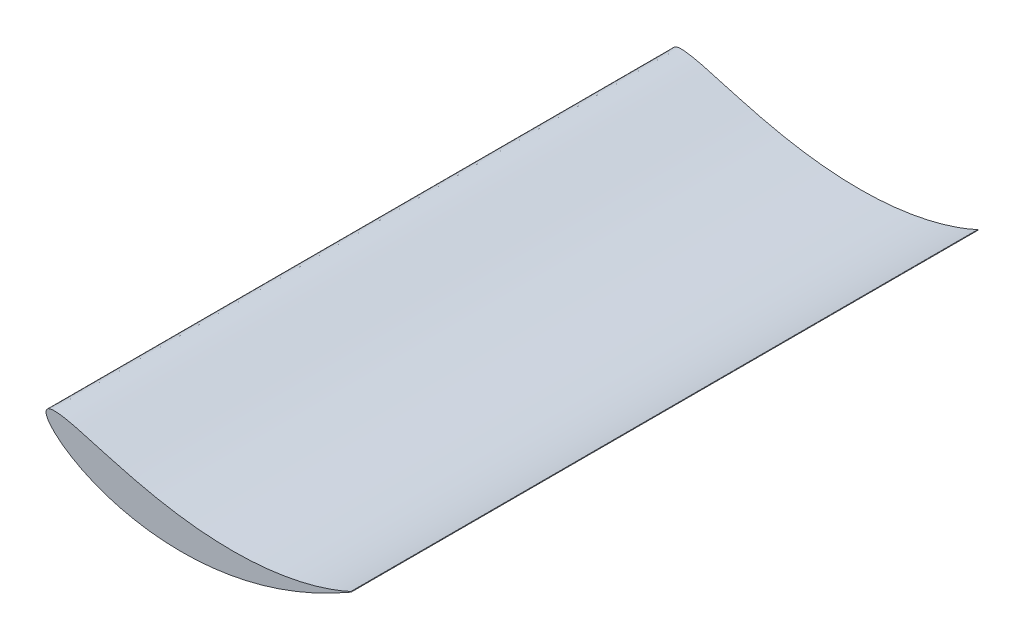
from build123d import *

# Parameters (mm, degrees)
BOSS_EXTRUDE2_DEPTH = 500


with BuildPart() as part:
    # Sketch2 → Boss-Extrude2 (new, symmetric)
    with BuildSketch(Plane.XY):
        with BuildLine():
            ThreePointArc((486.297107451, -5.955838871), (486.865467215, -6.163964732), (486.657341354, -6.732324496))
            add(Edge.make_bspline(
                [(486.657341354, -6.732324496), (486.085638681, -7.056803481), (482.737532209, -8.953874272), (475.692175775, -12.911374054), (465.027145931, -18.734013162), (452.059119689, -25.536817328), (436.745588209, -33.140035794), (418.978397723, -41.348940706), (398.720874382, -49.886819135), (375.984909337, -58.412627358), (350.871366032, -66.532244484), (323.583875558, -73.812245625), (294.448930192, -79.809999696), (263.923663215, -84.120783874), (232.585014862, -86.408901175), (201.106623036, -86.462741663), (170.214216607, -84.217503698), (140.63324318, -79.774847379), (113.030669073, -73.39455348), (87.96637545, -65.466171539), (65.858872986, -56.463508082), (46.969162599, -46.89825456), (31.408241789, -37.267341179), (19.150516889, -28.013211682), (10.069010687, -19.508121961), (3.934132524, -11.99072846), (0.503662154, -5.631657248), (-0.53367901, -0.172475), (1.492670981, 4.187443711), (5.893030709, 6.454297199), (11.682405006, 7.29776893), (19.00529138, 7.077241695), (27.747913772, 5.882814064), (37.807861153, 3.847470105), (49.056702722, 1.10037089), (61.379777071, -2.217393366), (74.669769987, -5.965783862), (88.827003183, -10.009880364), (103.758452795, -14.219721825), (119.375611208, -18.472703545), (135.59179972, -22.65983588), (152.323069565, -26.678329636), (169.48580699, -30.438615091), (186.996530715, -33.861731327), (204.771850025, -36.87924742), (222.727377844, -39.436749136), (240.778620987, -41.487580019), (258.840407224, -42.999573286), (276.827465416, -43.950404075), (294.654613529, -44.329101932), (312.237185774, -44.135814737), (329.490994921, -43.380801435), (346.333229212, -42.085851919), (362.682058467, -40.282322879), (378.457987231, -38.012145853), (393.582947296, -35.324942827), (407.98179128, -32.280959092), (421.581250587, -28.948698629), (434.311550958, -25.405931965), (446.103295612, -21.734112101), (456.892120036, -18.02615776), (466.6111661, -14.378717883), (475.204808059, -10.890304635), (481.625158416, -8.100154551), (485.196628153, -6.466382712), (486.297107451, -5.955838871)],
                knots=[0.014457573, 0.014457573, 0.014457573, 0.014457573, 0.016354527, 0.025589209, 0.037067816, 0.050854502, 0.066985023, 0.085457836, 0.106225288, 0.129179984, 0.15414868, 0.180883335, 0.209058052, 0.238271881, 0.268058238, 0.297903876, 0.327269841, 0.355623842, 0.382465397, 0.407355501, 0.429934859, 0.449938972, 0.46720151, 0.481654744, 0.493326476, 0.502345384, 0.508967218, 0.513683959, 0.517466281, 0.521650737, 0.527066359, 0.533951819, 0.542299609, 0.552017631, 0.562981801, 0.575062675, 0.588129088, 0.602056582, 0.616727009, 0.632028814, 0.64785818, 0.664118458, 0.680718254, 0.697573164, 0.714603084, 0.731732438, 0.748889669, 0.766005495, 0.783014285, 0.799851871, 0.816455186, 0.832763309, 0.848714238, 0.864246917, 0.879299022, 0.893808281, 0.907709696, 0.920937867, 0.933423618, 0.945096562, 0.955881369, 0.965700785, 0.974472498, 0.982111553, 0.985540881, 0.985540881, 0.985540881, 0.985540881], degree=3))
        make_face()
    extrude(amount=BOSS_EXTRUDE2_DEPTH, both=True)


solid = part.part
